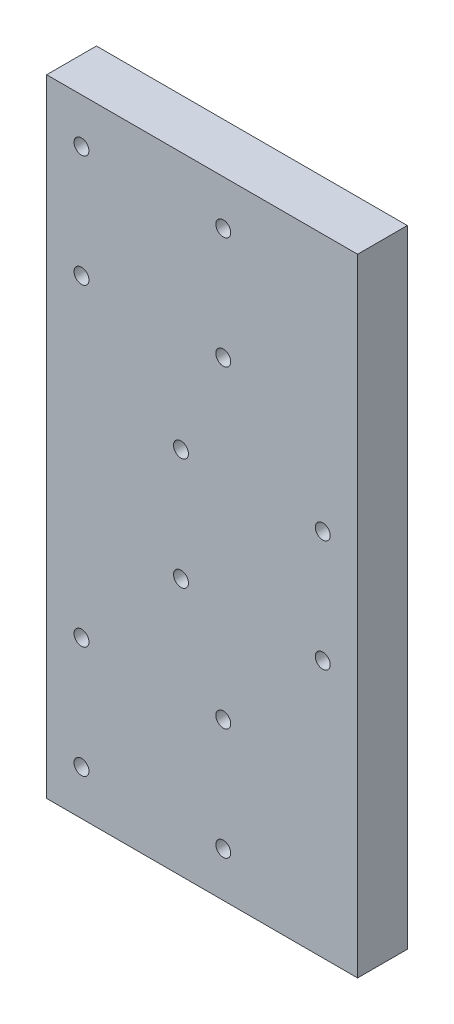
from build123d import *

# Parameters (mm, degrees)
ESTRUSIONE_ESTRUSIONE1_DEPTH = 20
SCHIZZO5_R                   = 3
TAGLIO_ESTRUSIONE1_DEPTH     = 144.181702742


with BuildPart() as part:
    # Schizzo1 → Estrusione-Estrusione1 (new body)
    with BuildSketch(Plane.XY):
        Polygon((60, 126), (60, -126), (-65, -126), (-65, 126), (-60, 126), align=None)
    extrude(amount=ESTRUSIONE_ESTRUSIONE1_DEPTH)

    # Schizzo5 → Taglio-Estrusione1 (cut, through all)
    with BuildSketch(Plane(origin=(0, 0, 0), x_dir=(-1, 0, 0), z_dir=(0, 0, -1))):
        with Locations((51, 108)):
            Circle(SCHIZZO5_R)
        with Locations((51, 63)):
            Circle(SCHIZZO5_R)
        with Locations((-6, 108)):
            Circle(SCHIZZO5_R)
        with Locations((-6, 63)):
            Circle(SCHIZZO5_R)
        with Locations((11.000000001, 22.499999999)):
            Circle(SCHIZZO5_R)
        with Locations((11.000000001, -22.500000001)):
            Circle(SCHIZZO5_R)
        with Locations((-45.999999999, 22.499999999)):
            Circle(SCHIZZO5_R)
        with Locations((-45.999999999, -22.500000001)):
            Circle(SCHIZZO5_R)
        with Locations((-6, -63)):
            Circle(SCHIZZO5_R)
        with Locations((-6, -108)):
            Circle(SCHIZZO5_R)
        with Locations((51, -63)):
            Circle(SCHIZZO5_R)
        with Locations((51, -108)):
            Circle(SCHIZZO5_R)
    extrude(amount=-TAGLIO_ESTRUSIONE1_DEPTH, mode=Mode.SUBTRACT)


solid = part.part
